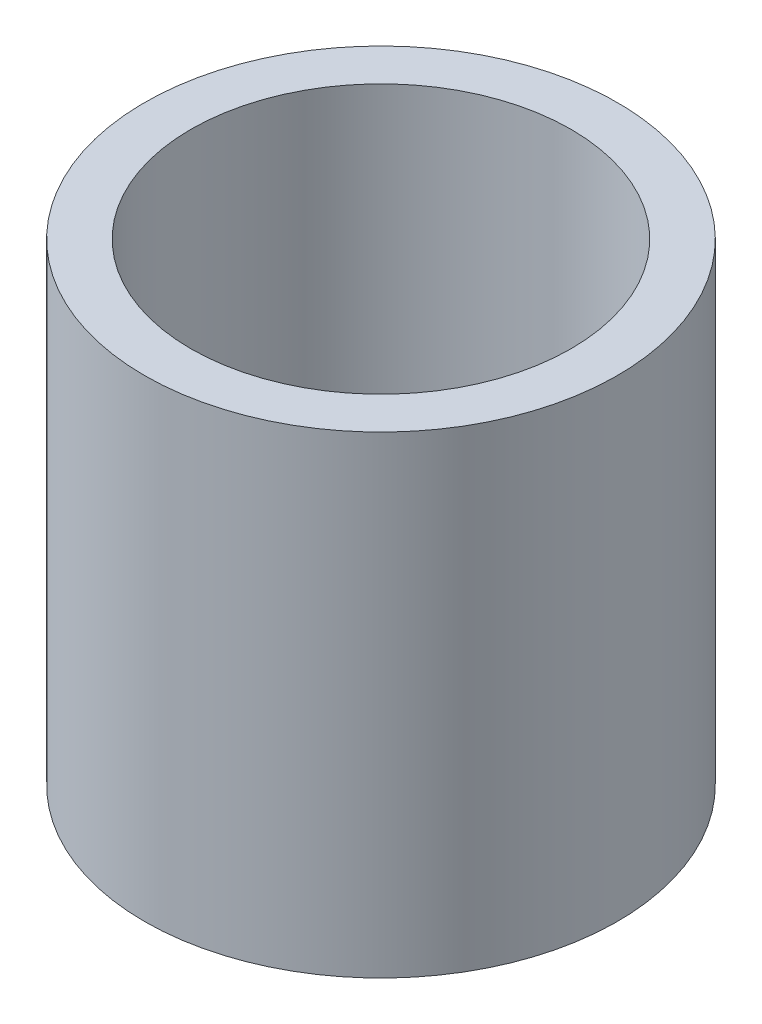
from build123d import *

# Parameters (mm, degrees)
SKETCH1_R               = 3.175
BOSS_EXTRUDE1_DEPTH     = 6.35
F_1_4_20_TAPPED_HOLE1_D = 5.1054


with BuildPart() as part:
    # Sketch1 → Boss-Extrude1 (new body)
    with BuildSketch(Plane(origin=(0, 0, 0), x_dir=(1, 0, 0), z_dir=(0, 1, 0))):
        with Locations(Location((0, 0, 0), (0, 0, 270))):
            Circle(SKETCH1_R)
    extrude(amount=BOSS_EXTRUDE1_DEPTH)

    # 1/4-20 Tapped Hole1 (through all)
    with Locations(Plane(origin=(0, 6.35, 0), x_dir=(1, 0, 0), z_dir=(0, 1, 0))):
        with Locations((0, 0)):
            Hole(F_1_4_20_TAPPED_HOLE1_D / 2)


solid = part.part
